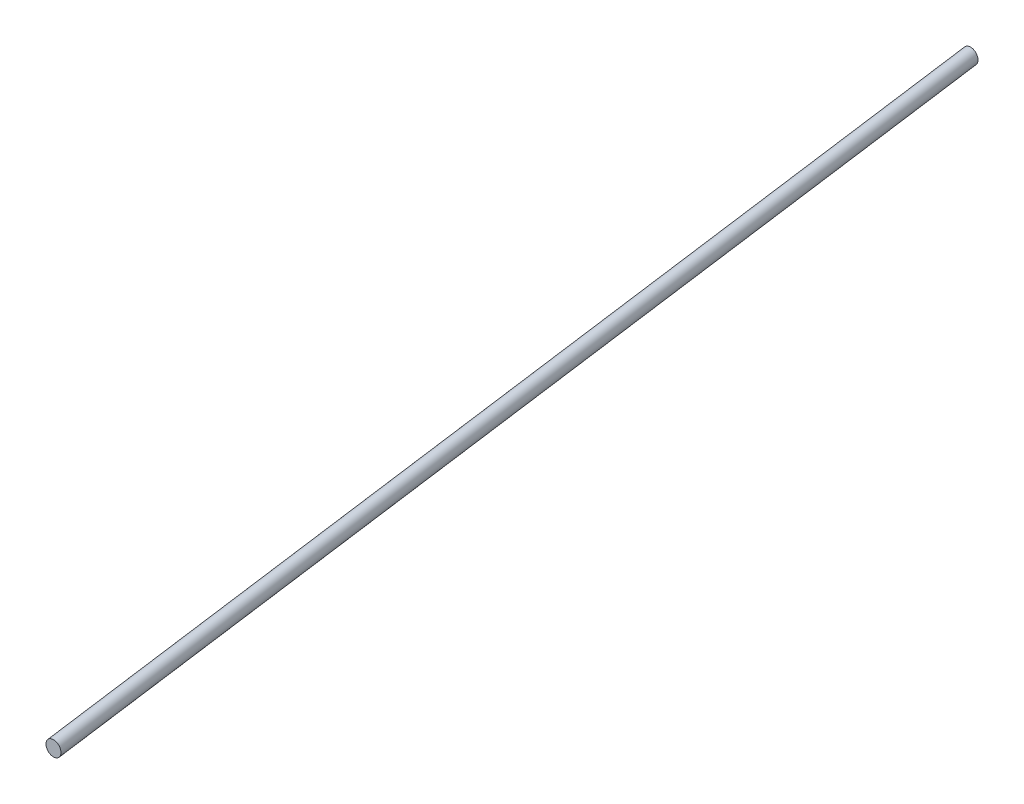
from build123d import *

# Parameters (mm, degrees)
SKETCH_6_R = 4


with BuildPart() as part:
    # 扫描1: sweep along a path in 草图4
    with BuildLine(Plane(origin=(0, 0, 0), x_dir=(1, 0, 0), z_dir=(0, 1, 0))) as sweep_1_path:
        Line((-54.999999974, -1.98e-07), (20.440278066, -564.985632272))
    # 草图6 → 扫描1 (sweep)
    with BuildSketch(Plane.XY):
        with Locations((19.1, 2.1)):
            Circle(SKETCH_6_R)
    sweep(path=sweep_1_path.line)


solid = part.part
